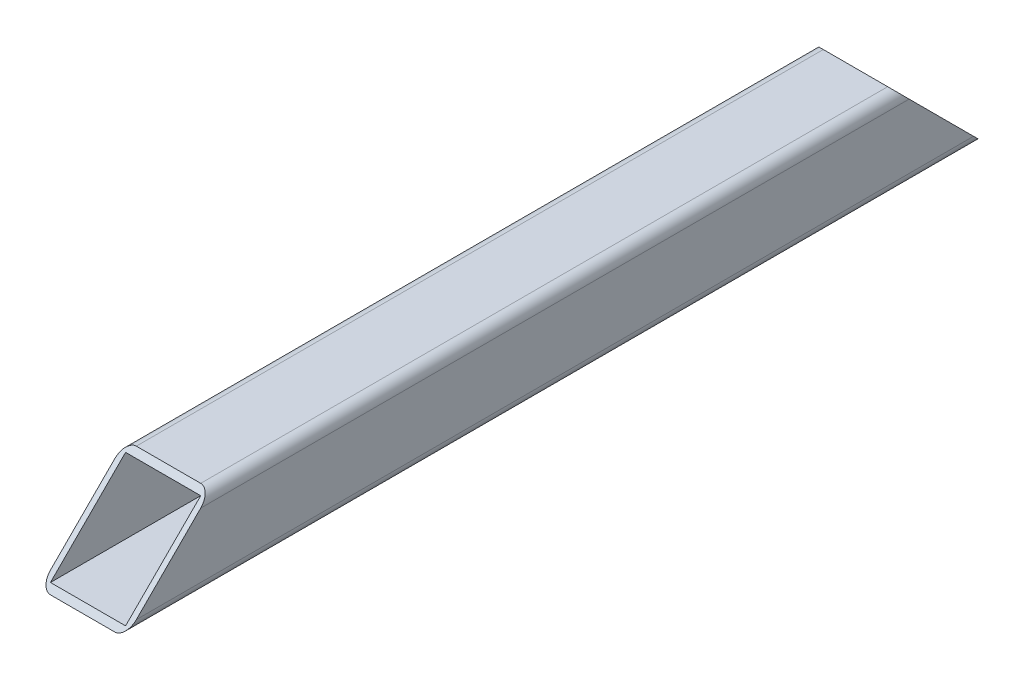
from build123d import *

# Parameters (mm, degrees)
SKETCH1_W           = 50.8
SKETCH1_H           = 50.8
SKETCH1_W_2         = 44.45
SKETCH1_H_2         = 44.45
BOSS_EXTRUDE1_DEPTH = 254
FILLET1_R           = 6.35
CUT_EXTRUDE1_DEPTH  = 914.4


with BuildPart() as part:
    # Sketch1 → Boss-Extrude1 (new, symmetric)
    with BuildSketch(Plane.XY):
        Rectangle(SKETCH1_W, SKETCH1_H)
        Rectangle(SKETCH1_W_2, SKETCH1_H_2, mode=Mode.SUBTRACT)
    extrude(amount=BOSS_EXTRUDE1_DEPTH, both=True)

    # Fillet1
    fillet1_edges = [part.edges().sort_by_distance(p)[0] for p in [
        (-25.4, 25.4, 0),
        (25.4, 25.4, 0),
        (25.4, -25.4, 0),
        (-25.4, -25.4, 0),
    ]]
    fillet(fillet1_edges, radius=FILLET1_R)

    # Sketch2 → Cut-Extrude1 (cut)
    with BuildSketch(Plane.ZY.offset(25.4)):
        Polygon((254, -25.4), (203.2, 25.4), (254, 25.4), align=None)
        Polygon((-254, 25.4), (-254, -25.4), (-203.2, 25.4), align=None)
    extrude(amount=-CUT_EXTRUDE1_DEPTH, mode=Mode.SUBTRACT)


solid = part.part
